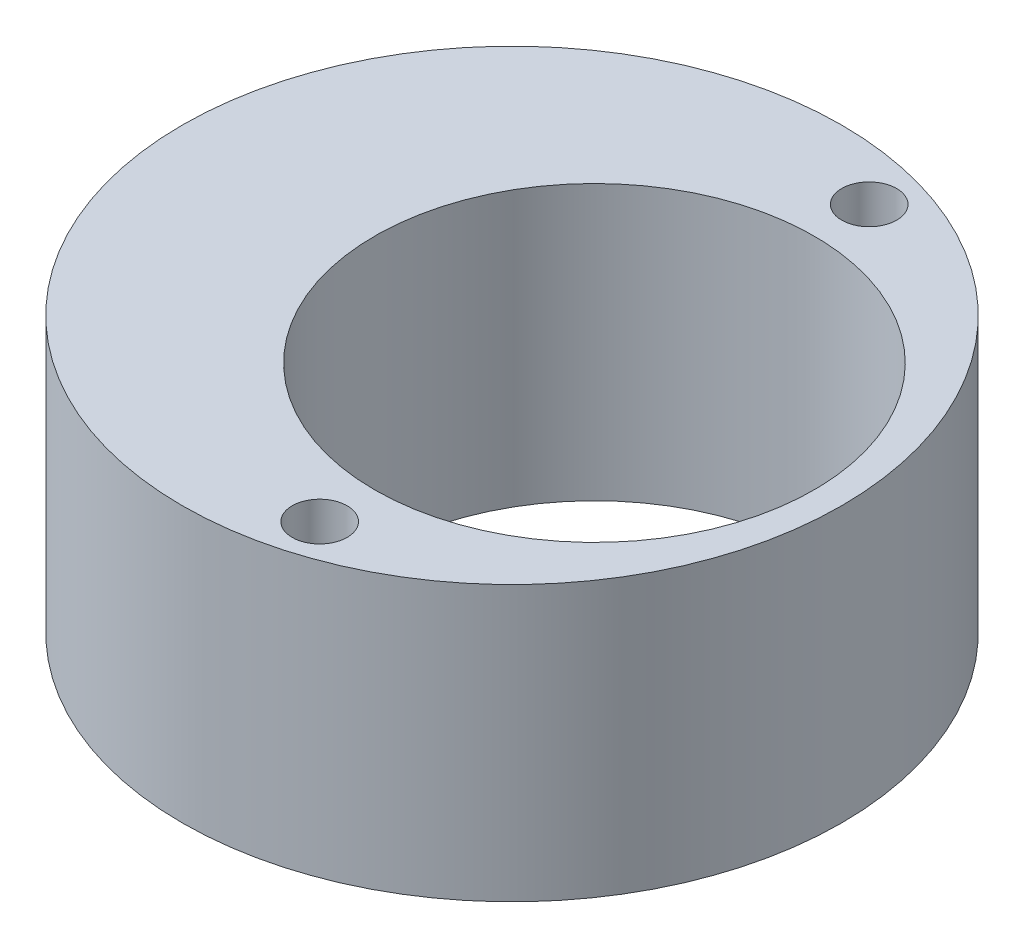
from build123d import *

# Parameters (mm, degrees)
SKETCH1_R           = 6
SKETCH1_R_2         = 4
SKETCH1_R_3         = 0.5
BOSS_EXTRUDE1_DEPTH = 5


with BuildPart() as part:
    # Sketch1 → Boss-Extrude1 (new body)
    with BuildSketch(Plane(origin=(0, 0, 0), x_dir=(1, 0, 0), z_dir=(0, 1, 0))):
        with Locations(Location((-1.5, 0, 0), (0, 0, 270))):
            Circle(SKETCH1_R)
        with Locations(Location((0, 0, 0), (0, 0, 270))):
            Circle(SKETCH1_R_2, mode=Mode.SUBTRACT)
        with Locations(Location((0, 5, 0), (0, 0, 270))):
            Circle(SKETCH1_R_3, mode=Mode.SUBTRACT)
        with Locations(Location((0, -5, 0), (0, 0, 270))):
            Circle(SKETCH1_R_3, mode=Mode.SUBTRACT)
    extrude(amount=BOSS_EXTRUDE1_DEPTH)


solid = part.part
